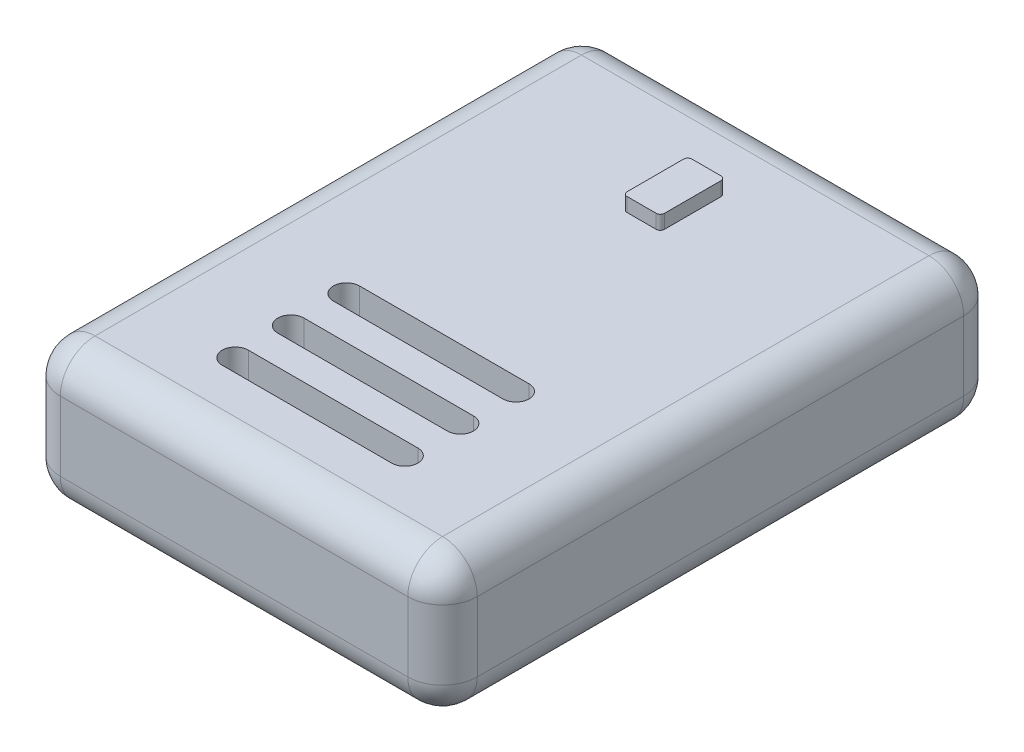
from build123d import *

# Parameters (mm, degrees)
SKETCH1_W           = 76.2
SKETCH1_H           = 101.6
BOSS_EXTRUDE1_DEPTH = 25.4
FILLET1_R           = 6.35
CUT_EXTRUDE1_DEPTH  = 6.35
SKETCH4_W           = 6.834349176
SKETCH4_H           = 11.846205237
BOSS_EXTRUDE2_DEPTH = 2.54
FILLET2_R           = 0.762


with BuildPart() as part:
    # Sketch1 → Boss-Extrude1 (new body)
    with BuildSketch(Plane(origin=(0, 0, 0), x_dir=(1, 0, 0), z_dir=(0, 1, 0))):
        Rectangle(SKETCH1_W, SKETCH1_H)
    extrude(amount=BOSS_EXTRUDE1_DEPTH)

    # Fillet1
    fillet1_edges = [part.edges().sort_by_distance(p)[0] for p in [
        (38.1, 25.4, 0),
        (0, 25.4, -50.8),
        (-38.1, 25.4, 0),
        (0, 0, -50.8),
        (38.1, 0, 0),
        (0, 0, 50.8),
        (-38.1, 0, 0),
        (0, 25.4, 50.8),
        (-38.1, 12.7, -50.8),
        (38.1, 12.7, -50.8),
        (38.1, 12.7, 50.8),
        (-38.1, 12.7, 50.8),
    ]]
    fillet(fillet1_edges, radius=FILLET1_R)

    # Sketch3 → Cut-Extrude1 (cut)
    with BuildSketch(Plane(origin=(0, 25.4, 0), x_dir=(1, 0, 0), z_dir=(0, 1, 0))):
        with BuildLine():
            Line((15.491191464, -37.475014645), (-15.491191464, -37.475014645))
            ThreePointArc((-15.491191464, -37.475014645), (-17.883213675, -35.082992433), (-15.491191464, -32.690970222))
            Line((-15.491191464, -32.690970222), (15.491191464, -32.690970222))
            ThreePointArc((15.491191464, -32.690970222), (17.883213675, -35.082992433), (15.491191464, -37.475014645))
        make_face()
        with BuildLine():
            Line((15.491191464, -27.315014645), (-15.491191464, -27.315014645))
            ThreePointArc((-15.491191464, -27.315014645), (-17.883213675, -24.922992433), (-15.491191464, -22.530970222))
            Line((-15.491191464, -22.530970222), (15.491191464, -22.530970222))
            ThreePointArc((15.491191464, -22.530970222), (17.883213675, -24.922992433), (15.491191464, -27.315014645))
        make_face()
        with BuildLine():
            Line((15.491191464, -17.155014645), (-15.491191464, -17.155014645))
            ThreePointArc((-15.491191464, -17.155014645), (-17.883213675, -14.762992433), (-15.491191464, -12.370970222))
            Line((-15.491191464, -12.370970222), (15.491191464, -12.370970222))
            ThreePointArc((15.491191464, -12.370970222), (17.883213675, -14.762992433), (15.491191464, -17.155014645))
        make_face()
    extrude(amount=-CUT_EXTRUDE1_DEPTH, mode=Mode.SUBTRACT)

    # Sketch4 → Boss-Extrude2 (add)
    with BuildSketch(Plane(origin=(0, 25.4, 0), x_dir=(1, 0, 0), z_dir=(0, 1, 0))):
        with Locations((0, 29.615513094)):
            Rectangle(SKETCH4_W, SKETCH4_H)
    extrude(amount=BOSS_EXTRUDE2_DEPTH)

    # Fillet2
    fillet2_edges = [part.edges().sort_by_distance(p)[0] for p in [
        (-3.417174588, 26.67, -35.538615712),
        (-3.417174588, 26.67, -23.692410475),
        (3.417174588, 26.67, -23.692410475),
        (3.417174588, 26.67, -35.538615712),
    ]]
    fillet(fillet2_edges, radius=FILLET2_R)


solid = part.part
